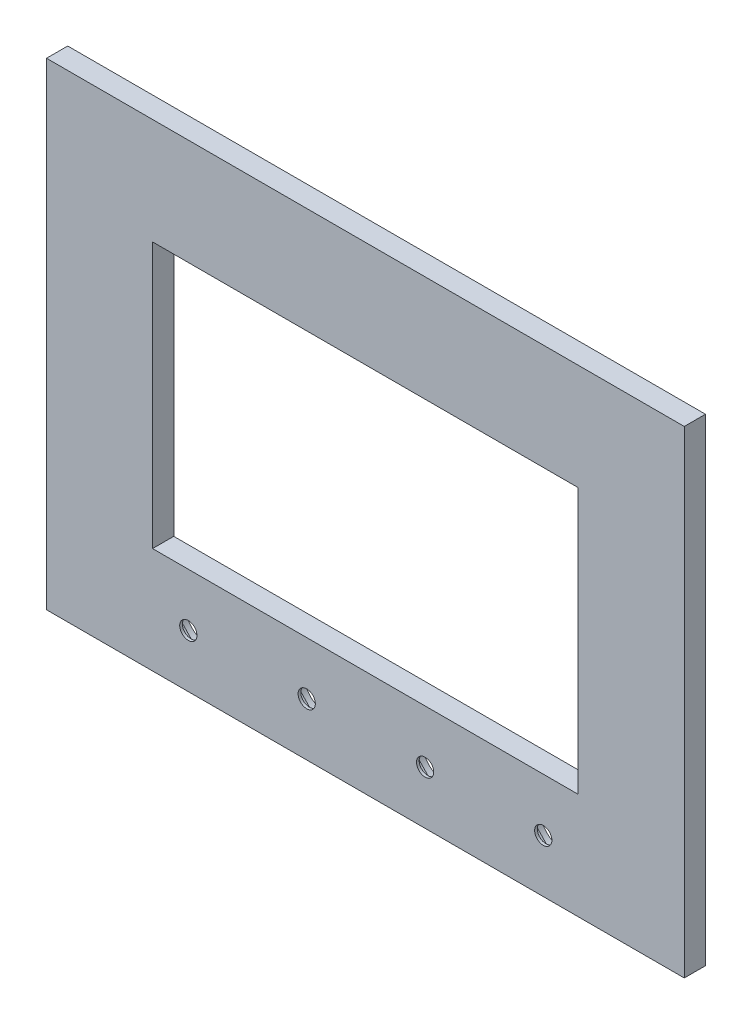
from build123d import *

# Parameters (mm, degrees)
SKETCH1_W                      = 240.6
SKETCH1_H                      = 180.2
BOSS_EXTRUDE1_DEPTH            = 8
SKETCH2_W                      = 160.6
SKETCH2_H                      = 100.2
CUT_EXTRUDE1_DEPTH             = 200.503872501
CUT_EXTRUDE2_DEPTH             = 7
CUT_EXTRUDE3_DEPTH             = 7
CUT_EXTRUDE4_DEPTH             = 7
CUT_EXTRUDE5_DEPTH             = 7
F_6_5_6_5_DIAMETER_HOLE1_D     = 6.5
F_6_5_6_5_DIAMETER_HOLE1_DEPTH = 8
SKETCH9_R                      = 9.267416037
SKETCH9_R_2                    = 9.269178346
SKETCH9_R_3                    = 9.266671768
CUT_EXTRUDE7_DEPTH             = 4
SKETCH10_R                     = 1.5
CUT_EXTRUDE8_DEPTH             = 0.5


with BuildPart() as part:
    # Sketch1 → Boss-Extrude1 (new body)
    with BuildSketch(Plane(origin=(0, 0, 0), x_dir=(-1, 0, 0), z_dir=(0, 0, -1))):
        with Locations((-50.702318109, 12.34999924)):
            Rectangle(SKETCH1_W, SKETCH1_H)
    extrude(amount=-BOSS_EXTRUDE1_DEPTH)

    # Sketch2 → Cut-Extrude1 (cut, through all)
    with BuildSketch(Plane.XY.offset(8)):
        with Locations((50.702318109, 12.34999924)):
            Rectangle(SKETCH2_W, SKETCH2_H)
    extrude(amount=-CUT_EXTRUDE1_DEPTH, mode=Mode.SUBTRACT)

    # Sketch3 → Cut-Extrude2 (cut)
    with BuildSketch(Plane(origin=(0, 0, 0), x_dir=(-1, 0, 0), z_dir=(0, 0, -1))):
        Polygon((-117.686768689, -48.483328992), (-127.060792146, -58.198146757), (-117.921667286, -67.016672528), (-108.547643828, -57.301854763), align=None)
    extrude(amount=-CUT_EXTRUDE2_DEPTH, mode=Mode.SUBTRACT)

    # Sketch4 → Cut-Extrude3 (cut)
    with BuildSketch(Plane(origin=(0, 0, 0), x_dir=(-1, 0, 0), z_dir=(0, 0, -1))):
        Polygon((6.939207854, -58.198146757), (16.078332714, -67.016672528), (25.452356172, -57.301854763), (16.313231311, -48.483328992), align=None)
    extrude(amount=-CUT_EXTRUDE3_DEPTH, mode=Mode.SUBTRACT)

    # Sketch5 → Cut-Extrude4 (cut)
    with BuildSketch(Plane(origin=(0, 0, 0), x_dir=(-1, 0, 0), z_dir=(0, 0, -1))):
        Polygon((-37.727458813, -58.198146757), (-28.588333952, -67.016672528), (-19.214310494, -57.301854763), (-28.353435355, -48.483328992), align=None)
    extrude(amount=-CUT_EXTRUDE4_DEPTH, mode=Mode.SUBTRACT)

    # Sketch6 → Cut-Extrude5 (cut)
    with BuildSketch(Plane(origin=(0, 0, 0), x_dir=(-1, 0, 0), z_dir=(0, 0, -1))):
        Polygon((-82.39412548, -58.198146757), (-73.255000619, -67.016672528), (-63.880977161, -57.301854763), (-73.020102022, -48.483328992), align=None)
    extrude(amount=-CUT_EXTRUDE5_DEPTH, mode=Mode.SUBTRACT)

    # Ø6.5 (6.5) Diameter Hole1
    with Locations(Plane.XY.offset(8)):
        with Locations((117.804217987, -57.75000076), (-16.097681891, -57.75000076), (28.568984776, -57.75000076), (73.235651442, -57.75000076)):
            Hole(F_6_5_6_5_DIAMETER_HOLE1_D / 2, depth=F_6_5_6_5_DIAMETER_HOLE1_DEPTH)

    # Sketch9 → Cut-Extrude7 (cut)
    with BuildSketch(Plane(origin=(0, 0, 0), x_dir=(-1, 0, 0), z_dir=(0, 0, -1))):
        with Locations((-117.804217987, -57.75000076)):
            Circle(SKETCH9_R)
        with Locations((-73.235651442, -57.75000076)):
            Circle(SKETCH9_R_2)
        with Locations((-28.568984776, -57.75000076)):
            Circle(SKETCH9_R_2)
        with Locations((16.097681891, -57.75000076)):
            Circle(SKETCH9_R_3)
    extrude(amount=-CUT_EXTRUDE7_DEPTH, mode=Mode.SUBTRACT)

    # Sketch10 → Cut-Extrude8 (cut)
    with BuildSketch(Plane(origin=(0, 0, 0), x_dir=(-1, 0, 0), z_dir=(0, 0, -1))):
        with Locations((-127.002318109, 69.24999924)):
            Circle(SKETCH10_R)
        with Locations((29.997681891, 69.24999924)):
            Circle(SKETCH10_R)
        with Locations((29.997681891, -45.75000076)):
            Circle(SKETCH10_R)
        with Locations((-127.002318109, -45.75000076)):
            Circle(SKETCH10_R)
    extrude(amount=-CUT_EXTRUDE8_DEPTH, mode=Mode.SUBTRACT)


solid = part.part
